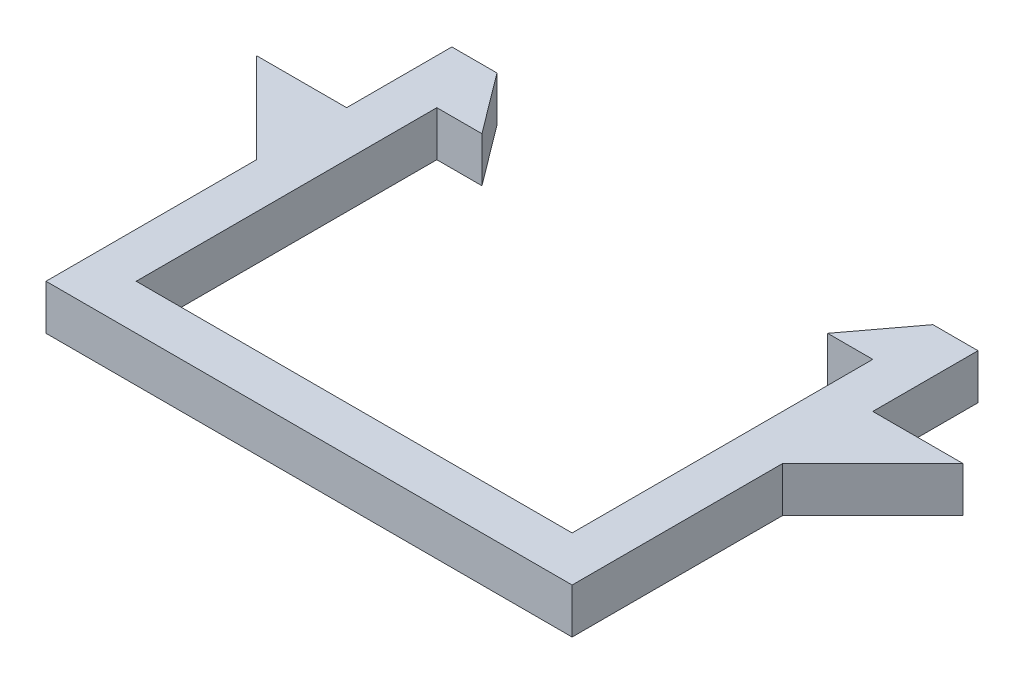
from build123d import *

# Parameters (mm, degrees)
BOSS_EXTRUDE1_DEPTH = 3


with BuildPart() as part:
    # Sketch1 → Boss-Extrude1 (new body)
    with BuildSketch(Plane(origin=(0, 0, 0), x_dir=(1, 0, 0), z_dir=(0, 1, 0))):
        Polygon((17.5, 0), (-17.5, 0), (-17.5, 14), (-23.5, 20), (-17.5, 20), (-17.5, 27), (-14.5, 27), (-11.5, 23), (-14.5, 23), (-14.5, 3), (14.5, 3), (14.5, 23), (11.5, 23), (14.5, 27), (17.5, 27), (17.5, 20), (23.5, 20), (17.5, 14), align=None)
    extrude(amount=BOSS_EXTRUDE1_DEPTH)


solid = part.part
